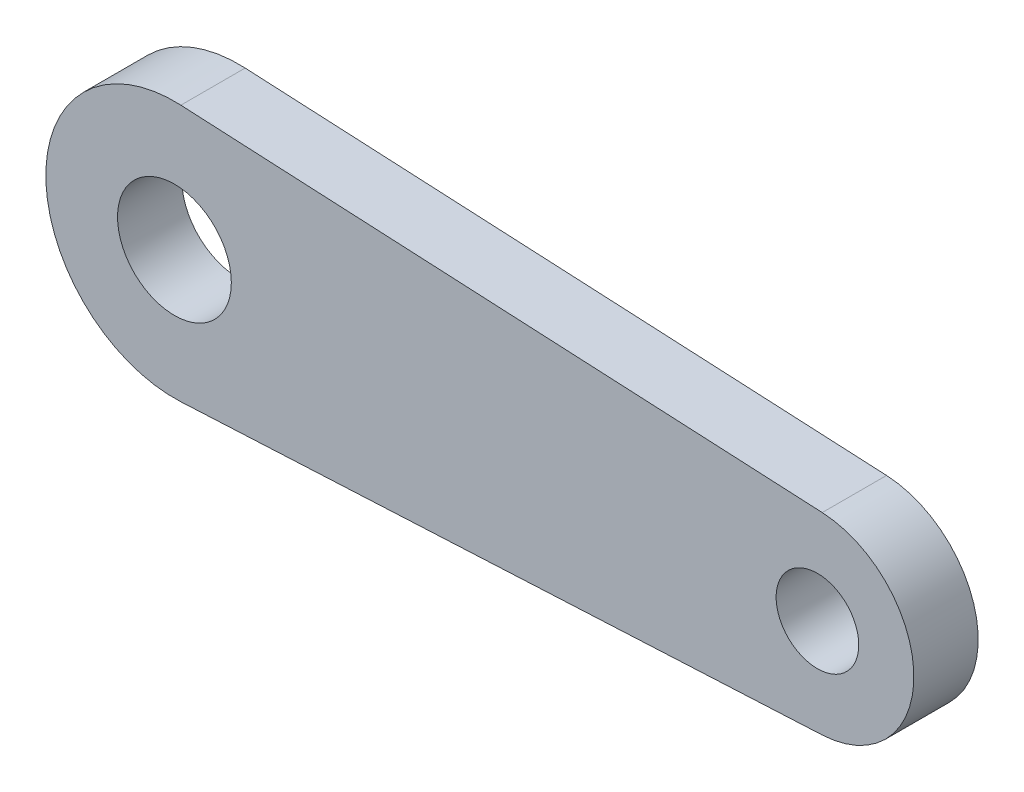
from build123d import *

# Parameters (mm, degrees)
BOSS_EXTRUDE1_DEPTH   = 2.54
F_8_CLEARANCE_HOLE1_D = 4.4958
F_4_CLEARANCE_HOLE1_D = 3.2639


with BuildPart() as part:
    # Sketch1 → Boss-Extrude1 (new body)
    with BuildSketch(Plane.XY):
        with BuildLine():
            Line((0.254, -5.073646026), (25.5905, -3.80523452))
            ThreePointArc((25.5905, -3.80523452), (29.21, 0), (25.5905, 3.80523452))
            Line((25.5905, 3.80523452), (0.254, 5.073646026))
            ThreePointArc((0.254, 5.073646026), (-5.08, 0), (0.254, -5.073646026))
        make_face()
    extrude(amount=BOSS_EXTRUDE1_DEPTH)

    # #8 Clearance Hole1 (through all)
    with Locations(Plane.XY.offset(2.54)):
        with Locations((0, 0)):
            Hole(F_8_CLEARANCE_HOLE1_D / 2)

    # #4 Clearance Hole1 (through all)
    with Locations(Plane(origin=(25.4, 0, 2.54), x_dir=(1, 0, 0), z_dir=(0, 0, 1))):
        with Locations((0, 0)):
            Hole(F_4_CLEARANCE_HOLE1_D / 2)


solid = part.part
